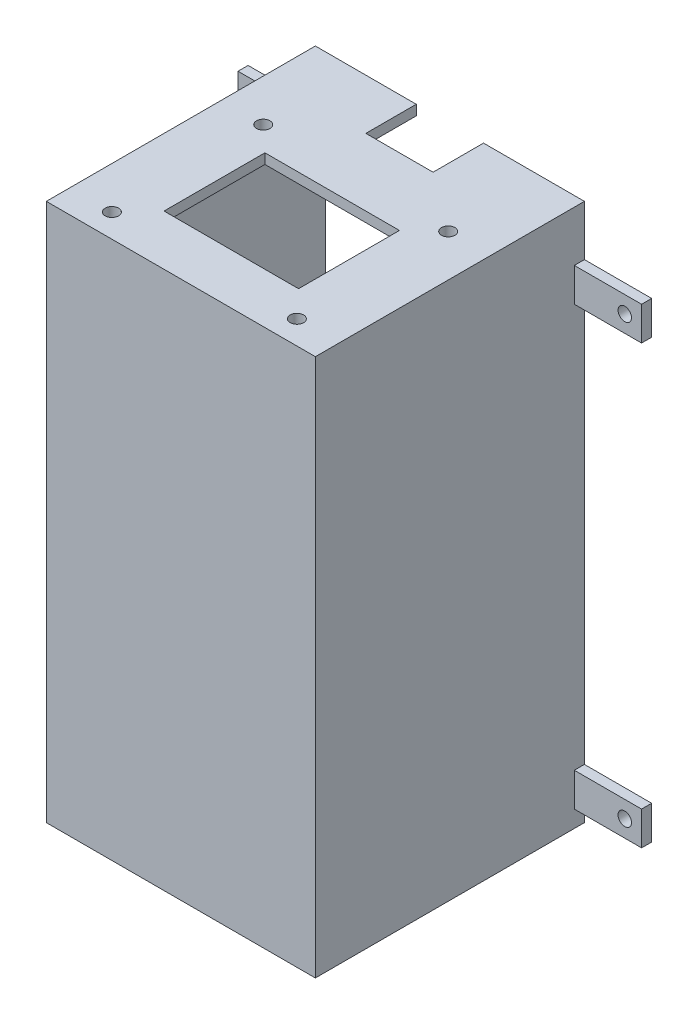
from build123d import *

# Parameters (mm, degrees)
SKETCH1_W           = 80
SKETCH1_H           = 160
BOSS_EXTRUDE1_DEPTH = 80
SHELL1_T            = -3
SKETCH2_W           = 40
SKETCH2_H           = 30
CUT_EXTRUDE1_DEPTH  = 70
SKETCH3_W           = 20
SKETCH3_H           = 15
CUT_EXTRUDE2_DEPTH  = 70
SKETCH4_W           = 70
SKETCH4_H           = 15
CUT_EXTRUDE3_DEPTH  = 70
SKETCH5_W           = 20
SKETCH5_H           = 10
SKETCH5_R           = 2
BOSS_EXTRUDE2_DEPTH = 3
SKETCH6_R           = 2
CUT_EXTRUDE4_DEPTH  = 3


with BuildPart() as part:
    # Sketch1 → Boss-Extrude1 (new body)
    with BuildSketch(Plane.XY):
        Rectangle(SKETCH1_W, SKETCH1_H)
    extrude(amount=BOSS_EXTRUDE1_DEPTH)

    # Shell1
    shell1_openings = [part.faces().sort_by_distance(p)[0] for p in [
        (0, 0, 0),
    ]]
    offset(amount=SHELL1_T, openings=shell1_openings, kind=Kind.INTERSECTION)

    # Sketch2 → Cut-Extrude1 (cut)
    with BuildSketch(Plane(origin=(0, 80, 0), x_dir=(1, 0, 0), z_dir=(0, 1, 0))):
        with Locations((0, -50)):
            Rectangle(SKETCH2_W, SKETCH2_H)
    extrude(amount=-CUT_EXTRUDE1_DEPTH, mode=Mode.SUBTRACT)

    # Sketch3 → Cut-Extrude2 (cut)
    with BuildSketch(Plane(origin=(0, 80, 0), x_dir=(1, 0, 0), z_dir=(0, 1, 0))):
        with Locations((0, -7.5)):
            Rectangle(SKETCH3_W, SKETCH3_H)
    extrude(amount=-CUT_EXTRUDE2_DEPTH, mode=Mode.SUBTRACT)

    # Sketch4 → Cut-Extrude3 (cut)
    with BuildSketch(Plane(origin=(0, -80, 0), x_dir=(-1, 0, 0), z_dir=(0, -1, 0))):
        with Locations((0, -7.5)):
            Rectangle(SKETCH4_W, SKETCH4_H)
    extrude(amount=-CUT_EXTRUDE3_DEPTH, mode=Mode.SUBTRACT)

    # Sketch5 → Boss-Extrude2 (add)
    # profile 1 of 2: a face of its own
    with BuildSketch(Plane(origin=(0, 0, 0), x_dir=(-1, 0, 0), z_dir=(0, 0, -1))):
        with Locations((50, 60)):
            Rectangle(SKETCH5_W, SKETCH5_H)
        with Locations((55, 60)):
            Circle(SKETCH5_R, mode=Mode.SUBTRACT)
    # profile 2 of 2: a face of its own
    with BuildSketch(Plane(origin=(0, 0, 0), x_dir=(-1, 0, 0), z_dir=(0, 0, -1))):
        with Locations((50, -70)):
            Rectangle(SKETCH5_W, SKETCH5_H)
        with Locations((55, -70)):
            Circle(SKETCH5_R, mode=Mode.SUBTRACT)
    boss_extrude2 = extrude(amount=-BOSS_EXTRUDE2_DEPTH)

    # Mirror1: Boss-Extrude2 across plane
    add(boss_extrude2.mirror(Plane(origin=(0, 0, 0), x_dir=(0, 0, 1), z_dir=(1, 0, 0))))

    # Sketch6 → Cut-Extrude4 (cut)
    with BuildSketch(Plane(origin=(0, 80, 0), x_dir=(1, 0, 0), z_dir=(0, 1, 0))):
        with Locations(Location((-27.5, -28, 0), (0, 0, 270))):
            Circle(SKETCH6_R)
        with Locations(Location((27.5, -28, 0), (0, 0, 270))):
            Circle(SKETCH6_R)
        with Locations(Location((27.5, -73, 0), (0, 0, 270))):
            Circle(SKETCH6_R)
        with Locations(Location((-27.5, -73, 0), (0, 0, 270))):
            Circle(SKETCH6_R)
    extrude(amount=-CUT_EXTRUDE4_DEPTH, mode=Mode.SUBTRACT)


solid = part.part
